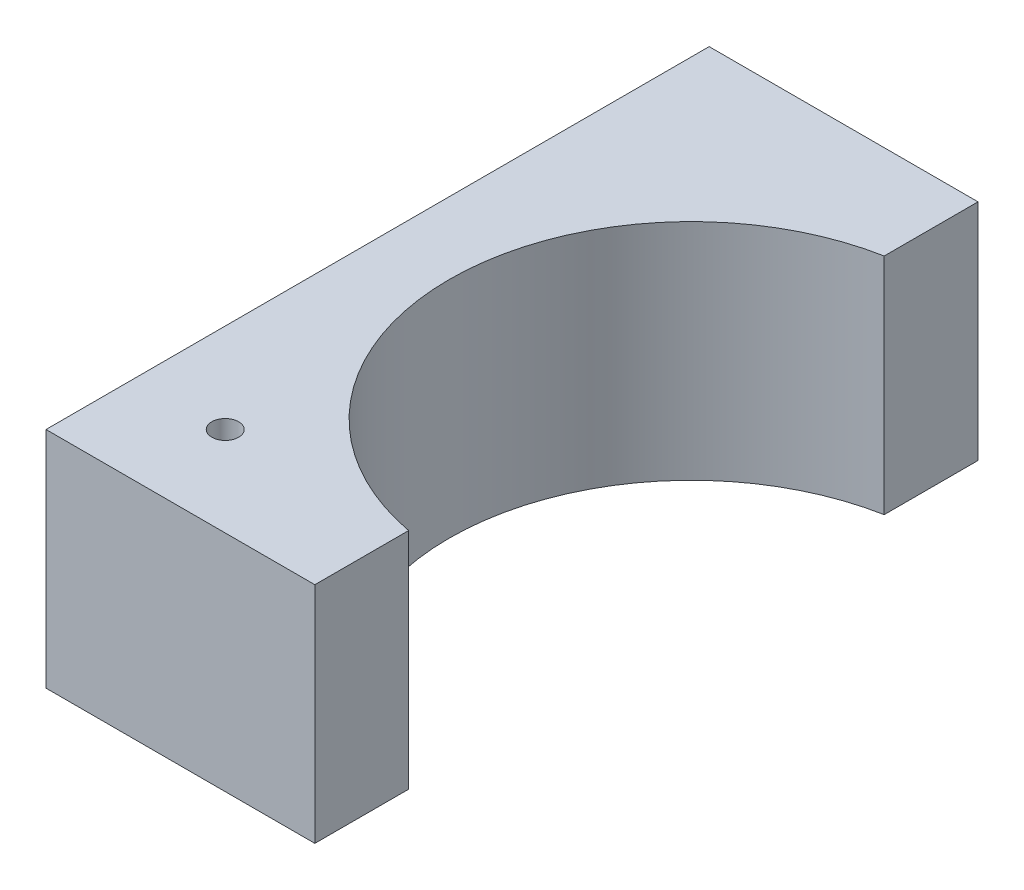
from build123d import *

# Parameters (mm, degrees)
SKETCH1_R           = 3
BOSS_EXTRUDE1_DEPTH = 50
SKETCH2_W           = 10
SKETCH2_H           = 148
CUT_EXTRUDE1_DEPTH  = 172.184111412


with BuildPart() as part:
    # Sketch1 → Boss-Extrude1 (new body)
    with BuildSketch(Plane(origin=(0, 0, 0), x_dir=(1, 0, 0), z_dir=(0, 1, 0))):
        with BuildLine():
            Line((0, 0), (0, 148))
            Line((0, 148), (70, 148))
            Line((70, 148), (70, 128))
            ThreePointArc((70, 128), (16, 74), (70, 20))
            Line((70, 20), (70, 0))
            Line((70, 0), (0, 0))
        make_face()
        with Locations(Location((20, 20, 0), (0, 0, 270))):
            Circle(SKETCH1_R, mode=Mode.SUBTRACT)
    extrude(amount=BOSS_EXTRUDE1_DEPTH)

    # Sketch2 → Cut-Extrude1 (cut, through all)
    with BuildSketch(Plane(origin=(0, 50, 0), x_dir=(1, 0, 0), z_dir=(0, 1, 0))):
        with Locations((65, 74)):
            Rectangle(SKETCH2_W, SKETCH2_H)
    extrude(amount=-CUT_EXTRUDE1_DEPTH, mode=Mode.SUBTRACT)


solid = part.part
